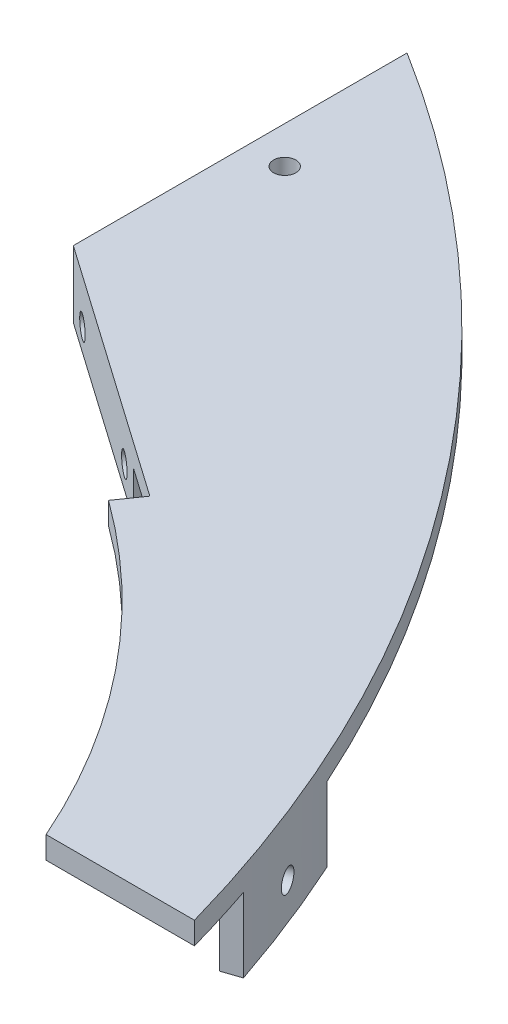
from build123d import *
from build123d.topology import SkipClean

# Parameters (mm, degrees)
BOSS_EXTRUDE1_DEPTH = 3
BOSS_EXTRUDE2_DEPTH = 6
SKETCH3_R           = 1.5
SKETCH3_W           = 9.001604742
SKETCH3_H           = 6
SKETCH3_W_2         = 4.02
CUT_EXTRUDE1_DEPTH  = 127.726009226
BOSS_EXTRUDE3_DEPTH = 3
BOSS_EXTRUDE4_START = 10
BOSS_EXTRUDE4_DEPTH = 10
SKETCH8_R           = 1.5
CUT_EXTRUDE2_DEPTH  = 128.550079345
SKETCH9_R           = 1.5
CUT_EXTRUDE3_DEPTH  = 140.296860914
CUT_EXTRUDE5_DEPTH  = 135.942804558
SKETCH10_R          = 1.5
CUT_EXTRUDE4_DEPTH  = 135.942804558


with BuildPart() as part:
    # Sketch1 → Boss-Extrude1 (new body)
    with BuildSketch(Plane(origin=(0, 0, 0), x_dir=(1, 0, 0), z_dir=(0, 1, 0))):
        with BuildLine():
            Line((0, 0), (20, 0))
            ThreePointArc((20, 0), (-12.999728612, 66.379532688), (-67.91, 116.18))
            Line((-67.91, 116.18), (-67.91, 72.58))
            ThreePointArc((-67.91, 72.58), (-27.76846685, 42.078474321), (0, 0))
        make_face()
    extrude(amount=BOSS_EXTRUDE1_DEPTH)

    # Sketch2 → Boss-Extrude2 (add)
    with BuildSketch(Plane.XZ):
        Polygon((-66.91, -70.583412503), (-32.50561414, -46.493202176), (-32.50561414, -51.376300531), (-67.91, -76.166718396), (-67.91, -71.283620041), align=None)
    extrude(amount=BOSS_EXTRUDE2_DEPTH)

    # Sketch3 → Cut-Extrude1 (cut, through all)
    with BuildSketch(Plane(origin=(13.44494558, 0, -19.201372231), x_dir=(-0.8191520442889929, 0, -0.5735764363510446), z_dir=(0.5735764363510446, 0, -0.819152044288993))):
        with Locations((90.296050234, -3)):
            Circle(SKETCH3_R)
        with Locations((67.296050234, -3)):
            Circle(SKETCH3_R)
        with Locations((57.795247863, -3)):
            Rectangle(SKETCH3_W, SKETCH3_H)
        with Locations((97.306050234, -3)):
            Rectangle(SKETCH3_W_2, SKETCH3_H)
    extrude(amount=-CUT_EXTRUDE1_DEPTH, mode=Mode.SUBTRACT)

    # Sketch5 → Boss-Extrude3 (add)
    with BuildSketch(Plane(origin=(0, 0, 0), x_dir=(1, 0, 0), z_dir=(0, 1, 0))):
        with BuildLine():
            Line((-66.911314527, 70.584332945), (-67.91, 70.584332945))
            Line((-67.91, 70.584332945), (-67.91, 72.58))
            ThreePointArc((-67.91, 72.58), (-27.76846685, 42.078474321), (0, 0))
            ThreePointArc((0, 0), (-14.53687211, 23.913782415), (-34.799919885, 43.216593999))
            Line((-34.799919885, 43.216593999), (-32.50561414, 46.493202176))
            Line((-32.50561414, 46.493202176), (-66.911314527, 70.584332945))
        make_face()
    extrude(amount=BOSS_EXTRUDE3_DEPTH)

    # Sketch6 → Boss-Extrude4 (add)
    with SkipClean():  # the faces are left unmerged after this step: merging them gives an invalid solid
        with BuildSketch(Plane.XZ.offset(BOSS_EXTRUDE4_START)):
            with BuildLine():
                Line((17.045225443, -9.553497125), (14.627759947, -8.739050999))
                ThreePointArc((14.627759947, -8.739050999), (11.241753199, -18.015971085), (7.396135604, -27.111987428))
                Line((7.396135604, -27.111987428), (9.72017103, -28.163805501))
                ThreePointArc((9.72017103, -28.163805501), (13.615472666, -18.950271792), (17.045225443, -9.553497125))
            make_face()
            with BuildLine():
                Line((-43.600864087, -98.631759771), (-45.244796978, -96.681132546))
                ThreePointArc((-45.244796978, -96.681132546), (-52.953020273, -102.854428394), (-60.960267052, -108.634591628))
                Line((-60.960267052, -108.634591628), (-59.519372567, -110.739653386))
                ThreePointArc((-59.519372567, -110.739653386), (-51.408674946, -104.884812453), (-43.600864087, -98.631759771))
            make_face()
        extrude(amount=-BOSS_EXTRUDE4_DEPTH)

    # Sketch8 → Cut-Extrude2 (cut, through all)
    with SkipClean():  # the faces are left unmerged after this step: merging them gives an invalid solid
        with BuildSketch(Plane(origin=(-51.408674946, -10, -104.884812453), x_dir=(-0.7959254239888501, 0, -0.6053946807233851), z_dir=(0.6053946807233851, 0, -0.7959254239888501))):
            with Locations((0, 5)):
                Circle(SKETCH8_R)
        extrude(amount=-CUT_EXTRUDE2_DEPTH, mode=Mode.SUBTRACT)

    # Sketch9 → Cut-Extrude3 (cut, through all)
    with SkipClean():  # the faces are left unmerged after this step: merging them gives an invalid solid
        with BuildSketch(Plane(origin=(18.247403502, 0, -7.182214333), x_dir=(-0.36625272068036274, 0, -0.9305154187837148), z_dir=(0.9305154187837148, 0, -0.36625272068036274))):
            with Locations((12.646816185, -5)):
                Circle(SKETCH9_R)
        extrude(amount=-CUT_EXTRUDE3_DEPTH, mode=Mode.SUBTRACT)

    # Sketch11 → Cut-Extrude5 (cut, through all)
    with SkipClean():  # the faces are left unmerged after this step: merging them gives an invalid solid
        with BuildSketch(Plane.XZ):
            with BuildLine():
                Line((-66.91, -70.583412503), (-66.91, -115.562519451))
                Line((-66.91, -115.562519451), (-66.91, -117.748905653))
                Line((-66.91, -117.748905653), (-78.626173162, -99.102139907))
                ThreePointArc((-78.626173162, -99.102139907), (-78.831832297, -91.769406487), (-72.513559714, -88.042382652))
                Line((-72.513559714, -88.042382652), (-69.539157742, -68.426897103))
                Line((-69.539157742, -68.426897103), (-66.91, -70.583412503))
            make_face()
        extrude(amount=-CUT_EXTRUDE5_DEPTH, mode=Mode.SUBTRACT)


with BuildPart() as cut_extrude5_piece_1:
    # of the separate pieces the step leaves, piece 1, a body of its own (cut_extrude5_pieces)
    add(part.part.solids().sort_by_distance((-64.617008782, 0, -73.860941122))[0])

    # Sketch10 → Cut-Extrude4 (cut, through all)
    with SkipClean():  # the faces are left unmerged after this step: merging them gives an invalid solid
        with BuildSketch(Plane.XZ):
            with Locations(Location((-61.91, -94.074364868, 0), (0, 0, 270))):
                Circle(SKETCH10_R)
        extrude(amount=-CUT_EXTRUDE4_DEPTH, mode=Mode.SUBTRACT)


with BuildPart() as cut_extrude5_piece_2:
    # of the separate pieces the step leaves, piece 2, a body of its own (cut_extrude5_pieces)
    add(part.part.solids().sort_by_distance((-67.91, 0, -116.18))[0])


solid = Compound([cut_extrude5_piece_1.part, cut_extrude5_piece_2.part])
